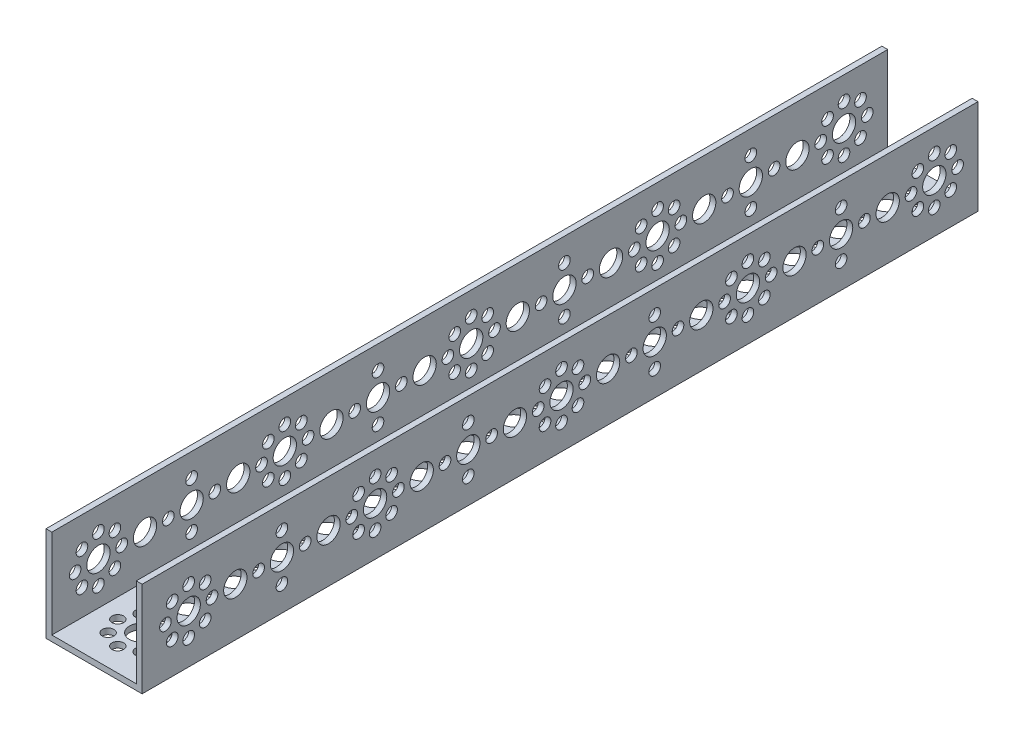
from build123d import *

# Parameters (mm, degrees)
BOSS_EXTRU_1_DEPTH                    = 287
ESQUISSE2_R                           = 4
ENL_V_MAT_EXTRU_1_DEPTH               = 291.724543168
R_P_TITION_LIN_AIRE1_COUNT            = 17
R_P_TITION_LIN_AIRE1_PITCH            = 16
ESQUISSE3_R                           = 2
ENL_V_MAT_EXTRU_2_DEPTH               = 291.724543168
R_P_TITION_CIRCULAIRE1_COUNT          = 4
R_P_TITION_CIRCULAIRE2_COUNT          = 8
R_P_TITION_LIN_AIRE2_COUNT            = 17
R_P_TITION_LIN_AIRE2_PITCH            = 16
R_P_TITION_LIN_AIRE2_COPY_1_SKETCH_R  = 2
R_P_TITION_LIN_AIRE2_COPY_1_DEPTH     = 291.724543168
R_P_TITION_LIN_AIRE2_COPY_2_SKETCH_R  = 2
R_P_TITION_LIN_AIRE2_COPY_2_DEPTH     = 291.724543168
R_P_TITION_LIN_AIRE2_COPY_3_SKETCH_R  = 2
R_P_TITION_LIN_AIRE2_COPY_3_DEPTH     = 291.724543168
R_P_TITION_LIN_AIRE2_COPY_4_SKETCH_R  = 2
R_P_TITION_LIN_AIRE2_COPY_4_DEPTH     = 291.724543168
R_P_TITION_LIN_AIRE2_COPY_5_SKETCH_R  = 2
R_P_TITION_LIN_AIRE2_COPY_5_DEPTH     = 291.724543168
R_P_TITION_LIN_AIRE2_COPY_6_SKETCH_R  = 2
R_P_TITION_LIN_AIRE2_COPY_6_DEPTH     = 291.724543168
R_P_TITION_LIN_AIRE2_COPY_7_SKETCH_R  = 2
R_P_TITION_LIN_AIRE2_COPY_7_DEPTH     = 291.724543168
R_P_TITION_LIN_AIRE2_COPY_8_SKETCH_R  = 2
R_P_TITION_LIN_AIRE2_COPY_8_DEPTH     = 291.724543168
R_P_TITION_LIN_AIRE2_COPY_9_SKETCH_R  = 2
R_P_TITION_LIN_AIRE2_COPY_9_DEPTH     = 291.724543168
R_P_TITION_LIN_AIRE2_COPY_10_SKETCH_R = 2
R_P_TITION_LIN_AIRE2_COPY_10_DEPTH    = 291.724543168
R_P_TITION_LIN_AIRE2_COPY_11_SKETCH_R = 2
R_P_TITION_LIN_AIRE2_COPY_11_DEPTH    = 291.724543168
R_P_TITION_LIN_AIRE2_COPY_12_SKETCH_R = 2
R_P_TITION_LIN_AIRE2_COPY_12_DEPTH    = 291.724543168
R_P_TITION_LIN_AIRE2_COPY_13_SKETCH_R = 2
R_P_TITION_LIN_AIRE2_COPY_13_DEPTH    = 291.724543168
R_P_TITION_LIN_AIRE2_COPY_14_SKETCH_R = 2
R_P_TITION_LIN_AIRE2_COPY_14_DEPTH    = 291.724543168
R_P_TITION_LIN_AIRE2_COPY_15_SKETCH_R = 2
R_P_TITION_LIN_AIRE2_COPY_15_DEPTH    = 291.724543168
R_P_TITION_LIN_AIRE2_COPY_16_SKETCH_R = 2
R_P_TITION_LIN_AIRE2_COPY_16_DEPTH    = 291.724543168
R_P_TITION_LIN_AIRE2_COPY_17_SKETCH_R = 2
R_P_TITION_LIN_AIRE2_COPY_17_DEPTH    = 291.724543168
R_P_TITION_LIN_AIRE2_COPY_18_SKETCH_R = 2
R_P_TITION_LIN_AIRE2_COPY_18_DEPTH    = 291.724543168
R_P_TITION_LIN_AIRE2_COPY_19_SKETCH_R = 2
R_P_TITION_LIN_AIRE2_COPY_19_DEPTH    = 291.724543168
R_P_TITION_LIN_AIRE2_COPY_20_SKETCH_R = 2
R_P_TITION_LIN_AIRE2_COPY_20_DEPTH    = 291.724543168
R_P_TITION_LIN_AIRE2_COPY_21_SKETCH_R = 2
R_P_TITION_LIN_AIRE2_COPY_21_DEPTH    = 291.724543168
R_P_TITION_LIN_AIRE2_COPY_22_SKETCH_R = 2
R_P_TITION_LIN_AIRE2_COPY_22_DEPTH    = 291.724543168
R_P_TITION_LIN_AIRE2_COPY_23_SKETCH_R = 2
R_P_TITION_LIN_AIRE2_COPY_23_DEPTH    = 291.724543168
R_P_TITION_LIN_AIRE2_COPY_24_SKETCH_R = 2
R_P_TITION_LIN_AIRE2_COPY_24_DEPTH    = 291.724543168
R_P_TITION_LIN_AIRE3_COPY_1_SKETCH_R  = 2
R_P_TITION_LIN_AIRE3_COPY_1_DEPTH     = 291.724543168
R_P_TITION_LIN_AIRE3_COPY_2_SKETCH_R  = 2
R_P_TITION_LIN_AIRE3_COPY_2_DEPTH     = 291.724543168
R_P_TITION_LIN_AIRE3_COPY_3_SKETCH_R  = 2
R_P_TITION_LIN_AIRE3_COPY_3_DEPTH     = 291.724543168
R_P_TITION_LIN_AIRE3_COPY_4_SKETCH_R  = 2
R_P_TITION_LIN_AIRE3_COPY_4_DEPTH     = 291.724543168
R_P_TITION_LIN_AIRE3_COPY_5_SKETCH_R  = 2
R_P_TITION_LIN_AIRE3_COPY_5_DEPTH     = 291.724543168
R_P_TITION_LIN_AIRE3_COPY_6_SKETCH_R  = 2
R_P_TITION_LIN_AIRE3_COPY_6_DEPTH     = 291.724543168
R_P_TITION_LIN_AIRE3_COPY_7_SKETCH_R  = 2
R_P_TITION_LIN_AIRE3_COPY_7_DEPTH     = 291.724543168
R_P_TITION_LIN_AIRE3_COPY_8_SKETCH_R  = 2
R_P_TITION_LIN_AIRE3_COPY_8_DEPTH     = 291.724543168
R_P_TITION_LIN_AIRE3_COPY_9_SKETCH_R  = 2
R_P_TITION_LIN_AIRE3_COPY_9_DEPTH     = 291.724543168
R_P_TITION_LIN_AIRE3_COPY_10_SKETCH_R = 2
R_P_TITION_LIN_AIRE3_COPY_10_DEPTH    = 291.724543168
R_P_TITION_LIN_AIRE3_COPY_11_SKETCH_R = 2
R_P_TITION_LIN_AIRE3_COPY_11_DEPTH    = 291.724543168
R_P_TITION_LIN_AIRE3_COPY_12_SKETCH_R = 2
R_P_TITION_LIN_AIRE3_COPY_12_DEPTH    = 291.724543168
R_P_TITION_LIN_AIRE3_COPY_13_SKETCH_R = 2
R_P_TITION_LIN_AIRE3_COPY_13_DEPTH    = 291.724543168
R_P_TITION_LIN_AIRE3_COPY_14_SKETCH_R = 2
R_P_TITION_LIN_AIRE3_COPY_14_DEPTH    = 291.724543168
R_P_TITION_LIN_AIRE3_COPY_15_SKETCH_R = 2
R_P_TITION_LIN_AIRE3_COPY_15_DEPTH    = 291.724543168
R_P_TITION_LIN_AIRE3_COPY_16_SKETCH_R = 2
R_P_TITION_LIN_AIRE3_COPY_16_DEPTH    = 291.724543168
R_P_TITION_LIN_AIRE3_COPY_17_SKETCH_R = 2
R_P_TITION_LIN_AIRE3_COPY_17_DEPTH    = 291.724543168
R_P_TITION_LIN_AIRE3_COPY_18_SKETCH_R = 2
R_P_TITION_LIN_AIRE3_COPY_18_DEPTH    = 291.724543168
R_P_TITION_LIN_AIRE3_COPY_19_SKETCH_R = 2
R_P_TITION_LIN_AIRE3_COPY_19_DEPTH    = 291.724543168
R_P_TITION_LIN_AIRE3_COPY_20_SKETCH_R = 2
R_P_TITION_LIN_AIRE3_COPY_20_DEPTH    = 291.724543168
SYM_TRIE2_COPY_1_SKETCH_R             = 4
SYM_TRIE2_COPY_1_DEPTH                = 291.724543168
SYM_TRIE2_COPY_2_SKETCH_R             = 4
SYM_TRIE2_COPY_2_DEPTH                = 291.724543168
SYM_TRIE2_COPY_3_SKETCH_R             = 4
SYM_TRIE2_COPY_3_DEPTH                = 291.724543168
SYM_TRIE2_COPY_4_SKETCH_R             = 4
SYM_TRIE2_COPY_4_DEPTH                = 291.724543168
SYM_TRIE2_COPY_5_SKETCH_R             = 4
SYM_TRIE2_COPY_5_DEPTH                = 291.724543168
SYM_TRIE2_COPY_6_SKETCH_R             = 4
SYM_TRIE2_COPY_6_DEPTH                = 291.724543168
SYM_TRIE2_COPY_7_SKETCH_R             = 4
SYM_TRIE2_COPY_7_DEPTH                = 291.724543168
SYM_TRIE2_COPY_8_SKETCH_R             = 4
SYM_TRIE2_COPY_8_DEPTH                = 291.724543168
SYM_TRIE2_COPY_9_SKETCH_R             = 4
SYM_TRIE2_COPY_9_DEPTH                = 291.724543168
SYM_TRIE2_COPY_10_SKETCH_R            = 4
SYM_TRIE2_COPY_10_DEPTH               = 291.724543168
SYM_TRIE2_COPY_11_SKETCH_R            = 4
SYM_TRIE2_COPY_11_DEPTH               = 291.724543168
SYM_TRIE2_COPY_12_SKETCH_R            = 4
SYM_TRIE2_COPY_12_DEPTH               = 291.724543168
SYM_TRIE2_COPY_13_SKETCH_R            = 4
SYM_TRIE2_COPY_13_DEPTH               = 291.724543168
SYM_TRIE2_COPY_14_SKETCH_R            = 4
SYM_TRIE2_COPY_14_DEPTH               = 291.724543168
SYM_TRIE2_COPY_15_SKETCH_R            = 4
SYM_TRIE2_COPY_15_DEPTH               = 291.724543168
SYM_TRIE2_COPY_16_SKETCH_R            = 4
SYM_TRIE2_COPY_16_DEPTH               = 291.724543168
SYM_TRIE2_COPY_17_SKETCH_R            = 2
SYM_TRIE2_COPY_17_DEPTH               = 291.724543168
SYM_TRIE2_COPY_18_SKETCH_R            = 2
SYM_TRIE2_COPY_18_DEPTH               = 291.724543168
SYM_TRIE2_COPY_19_SKETCH_R            = 2
SYM_TRIE2_COPY_19_DEPTH               = 291.724543168
SYM_TRIE2_COPY_20_SKETCH_R            = 2
SYM_TRIE2_COPY_20_DEPTH               = 291.724543168
SYM_TRIE2_COPY_21_SKETCH_R            = 2
SYM_TRIE2_COPY_21_DEPTH               = 291.724543168
SYM_TRIE2_COPY_22_SKETCH_R            = 2
SYM_TRIE2_COPY_22_DEPTH               = 291.724543168
SYM_TRIE2_COPY_23_SKETCH_R            = 2
SYM_TRIE2_COPY_23_DEPTH               = 291.724543168
SYM_TRIE2_COPY_24_SKETCH_R            = 2
SYM_TRIE2_COPY_24_DEPTH               = 291.724543168
SYM_TRIE2_COPY_25_SKETCH_R            = 2
SYM_TRIE2_COPY_25_DEPTH               = 291.724543168
SYM_TRIE2_COPY_26_SKETCH_R            = 2
SYM_TRIE2_COPY_26_DEPTH               = 291.724543168
SYM_TRIE2_COPY_27_SKETCH_R            = 2
SYM_TRIE2_COPY_27_DEPTH               = 291.724543168
SYM_TRIE2_COPY_28_SKETCH_R            = 2
SYM_TRIE2_COPY_28_DEPTH               = 291.724543168
SYM_TRIE2_COPY_29_SKETCH_R            = 2
SYM_TRIE2_COPY_29_DEPTH               = 291.724543168
SYM_TRIE2_COPY_30_SKETCH_R            = 2
SYM_TRIE2_COPY_30_DEPTH               = 291.724543168
SYM_TRIE2_COPY_31_SKETCH_R            = 2
SYM_TRIE2_COPY_31_DEPTH               = 291.724543168
SYM_TRIE2_COPY_32_SKETCH_R            = 2
SYM_TRIE2_COPY_32_DEPTH               = 291.724543168
SYM_TRIE2_COPY_33_SKETCH_R            = 2
SYM_TRIE2_COPY_33_DEPTH               = 291.724543168
SYM_TRIE2_COPY_34_SKETCH_R            = 2
SYM_TRIE2_COPY_34_DEPTH               = 291.724543168
SYM_TRIE2_COPY_35_SKETCH_R            = 2
SYM_TRIE2_COPY_35_DEPTH               = 291.724543168
SYM_TRIE2_COPY_36_SKETCH_R            = 2
SYM_TRIE2_COPY_36_DEPTH               = 291.724543168
SYM_TRIE2_COPY_37_SKETCH_R            = 2
SYM_TRIE2_COPY_37_DEPTH               = 291.724543168
SYM_TRIE2_COPY_38_SKETCH_R            = 2
SYM_TRIE2_COPY_38_DEPTH               = 291.724543168
SYM_TRIE2_COPY_39_SKETCH_R            = 2
SYM_TRIE2_COPY_39_DEPTH               = 291.724543168
SYM_TRIE2_COPY_40_SKETCH_R            = 2
SYM_TRIE2_COPY_40_DEPTH               = 291.724543168
SYM_TRIE2_COPY_41_SKETCH_R            = 2
SYM_TRIE2_COPY_41_DEPTH               = 291.724543168
SYM_TRIE2_COPY_42_SKETCH_R            = 2
SYM_TRIE2_COPY_42_DEPTH               = 291.724543168
SYM_TRIE2_COPY_43_SKETCH_R            = 2
SYM_TRIE2_COPY_43_DEPTH               = 291.724543168
SYM_TRIE2_COPY_44_SKETCH_R            = 2
SYM_TRIE2_COPY_44_DEPTH               = 291.724543168
SYM_TRIE2_COPY_45_SKETCH_R            = 2
SYM_TRIE2_COPY_45_DEPTH               = 291.724543168
SYM_TRIE2_COPY_46_SKETCH_R            = 2
SYM_TRIE2_COPY_46_DEPTH               = 291.724543168
SYM_TRIE2_COPY_47_SKETCH_R            = 2
SYM_TRIE2_COPY_47_DEPTH               = 291.724543168
SYM_TRIE2_COPY_48_SKETCH_R            = 2
SYM_TRIE2_COPY_48_DEPTH               = 291.724543168
SYM_TRIE2_COPY_49_SKETCH_R            = 2
SYM_TRIE2_COPY_49_DEPTH               = 291.724543168
SYM_TRIE2_COPY_50_SKETCH_R            = 2
SYM_TRIE2_COPY_50_DEPTH               = 291.724543168
SYM_TRIE2_COPY_51_SKETCH_R            = 2
SYM_TRIE2_COPY_51_DEPTH               = 291.724543168
SYM_TRIE2_COPY_52_SKETCH_R            = 2
SYM_TRIE2_COPY_52_DEPTH               = 291.724543168
SYM_TRIE2_COPY_53_SKETCH_R            = 2
SYM_TRIE2_COPY_53_DEPTH               = 291.724543168
SYM_TRIE2_COPY_54_SKETCH_R            = 2
SYM_TRIE2_COPY_54_DEPTH               = 291.724543168
SYM_TRIE2_COPY_55_SKETCH_R            = 2
SYM_TRIE2_COPY_55_DEPTH               = 291.724543168
SYM_TRIE2_COPY_56_SKETCH_R            = 2
SYM_TRIE2_COPY_56_DEPTH               = 291.724543168
SYM_TRIE2_COPY_57_SKETCH_R            = 2
SYM_TRIE2_COPY_57_DEPTH               = 291.724543168
SYM_TRIE2_COPY_58_SKETCH_R            = 2
SYM_TRIE2_COPY_58_DEPTH               = 291.724543168
SYM_TRIE2_COPY_59_SKETCH_R            = 2
SYM_TRIE2_COPY_59_DEPTH               = 291.724543168
SYM_TRIE2_COPY_60_SKETCH_R            = 2
SYM_TRIE2_COPY_60_DEPTH               = 291.724543168
SYM_TRIE2_COPY_61_SKETCH_R            = 2
SYM_TRIE2_COPY_61_DEPTH               = 291.724543168
SYM_TRIE2_COPY_62_SKETCH_R            = 2
SYM_TRIE2_COPY_62_DEPTH               = 291.724543168
SYM_TRIE2_COPY_63_SKETCH_R            = 2
SYM_TRIE2_COPY_63_DEPTH               = 291.724543168
SYM_TRIE2_COPY_64_SKETCH_R            = 2
SYM_TRIE2_COPY_64_DEPTH               = 291.724543168
SYM_TRIE2_COPY_65_SKETCH_R            = 2
SYM_TRIE2_COPY_65_DEPTH               = 291.724543168
SYM_TRIE2_COPY_66_SKETCH_R            = 2
SYM_TRIE2_COPY_66_DEPTH               = 291.724543168
SYM_TRIE2_COPY_67_SKETCH_R            = 2
SYM_TRIE2_COPY_67_DEPTH               = 291.724543168
SYM_TRIE2_COPY_68_SKETCH_R            = 2
SYM_TRIE2_COPY_68_DEPTH               = 291.724543168
SYM_TRIE2_COPY_69_SKETCH_R            = 2
SYM_TRIE2_COPY_69_DEPTH               = 291.724543168
SYM_TRIE2_COPY_70_SKETCH_R            = 2
SYM_TRIE2_COPY_70_DEPTH               = 291.724543168
SYM_TRIE2_COPY_71_SKETCH_R            = 2
SYM_TRIE2_COPY_71_DEPTH               = 291.724543168
SYM_TRIE2_COPY_72_SKETCH_R            = 2
SYM_TRIE2_COPY_72_DEPTH               = 291.724543168
SYM_TRIE2_COPY_73_SKETCH_R            = 2
SYM_TRIE2_COPY_73_DEPTH               = 291.724543168
SYM_TRIE2_COPY_74_SKETCH_R            = 2
SYM_TRIE2_COPY_74_DEPTH               = 291.724543168
SYM_TRIE2_COPY_75_SKETCH_R            = 2
SYM_TRIE2_COPY_75_DEPTH               = 291.724543168


with BuildPart() as part:
    # Esquisse1 → Boss.-Extru.1 (new body)
    with BuildSketch(Plane.XY):
        Polygon((0, 0), (0, 32.6), (2, 32.6), (2, 2), (31, 2), (31, 32.6), (33, 32.6), (33, 0), align=None)
    extrude(amount=BOSS_EXTRU_1_DEPTH)

    # Esquisse2 → Enlèv. mat.-Extru.1 (cut, symmetric)
    with BuildSketch(Plane(origin=(0, 0, 0), x_dir=(-1, 0, 0), z_dir=(0, -1, 0))):
        with Locations(Location((-16.65, -271, 0), (0, 0, 90))):
            Circle(ESQUISSE2_R)
    enl_v_mat_extru_1 = extrude(amount=ENL_V_MAT_EXTRU_1_DEPTH, both=True, mode=Mode.SUBTRACT)

    # Répétition linéaire1: Enlèv. mat.-Extru.1 ×17
    with Locations(*[(0, 0, -i * R_P_TITION_LIN_AIRE1_PITCH) for i in range(1, R_P_TITION_LIN_AIRE1_COUNT)]):
        add(enl_v_mat_extru_1, mode=Mode.SUBTRACT)

    # Esquisse3 → Enlèv. mat.-Extru.2 (cut, symmetric)
    with BuildSketch(Plane.XZ):
        with Locations(Location((24.65, 271, 0), (0, 0, 270))):
            Circle(ESQUISSE3_R)
    enl_v_mat_extru_2 = extrude(amount=ENL_V_MAT_EXTRU_2_DEPTH, both=True, mode=Mode.SUBTRACT)

    # Répétition circulaire1: Enlèv. mat.-Extru.2 ×4 about axis
    r_p_tition_circulaire1_axis = Axis((16.65, 0, 271), (0, 1, 0))
    for i in range(1, R_P_TITION_CIRCULAIRE1_COUNT):
        add(enl_v_mat_extru_2.rotate(r_p_tition_circulaire1_axis, i * 360 / R_P_TITION_CIRCULAIRE1_COUNT), mode=Mode.SUBTRACT)

    # Répétition circulaire2: Enlèv. mat.-Extru.2 ×8 about axis, 3 skipped
    r_p_tition_circulaire2_axis = Axis((16.65, 0, 271), (0, 1, 0))
    add([enl_v_mat_extru_2.rotate(r_p_tition_circulaire2_axis, i * 360 / R_P_TITION_CIRCULAIRE2_COUNT) for i in range(1, R_P_TITION_CIRCULAIRE2_COUNT) if i not in (2, 4, 6)], mode=Mode.SUBTRACT)

    # Répétition linéaire2: Enlèv. mat.-Extru.2 ×17, 8 skipped
    with Locations(*[(0, 0, -i * R_P_TITION_LIN_AIRE2_PITCH) for i in range(1, R_P_TITION_LIN_AIRE2_COUNT) if i not in (1, 3, 5, 7, 9, 11, 13, 15)]):
        add(enl_v_mat_extru_2, mode=Mode.SUBTRACT)

    # Répétition linéaire2 copy 1 sketch → Répétition linéaire2 copy 1 (cut, symmetric)
    with BuildSketch(Plane(origin=(-254.35, 0, 255.65), x_dir=(0, 0, -1), z_dir=(0, -1, 0))):
        with Locations(Location((24.65, 271, 0), (0, 0, 270))):
            Circle(R_P_TITION_LIN_AIRE2_COPY_1_SKETCH_R)
    extrude(amount=R_P_TITION_LIN_AIRE2_COPY_1_DEPTH, both=True, mode=Mode.SUBTRACT)

    # Répétition linéaire2 copy 2 sketch → Répétition linéaire2 copy 2 (cut, symmetric)
    with BuildSketch(Plane(origin=(-254.35, 0, 223.65), x_dir=(0, 0, -1), z_dir=(0, -1, 0))):
        with Locations(Location((24.65, 271, 0), (0, 0, 270))):
            Circle(R_P_TITION_LIN_AIRE2_COPY_2_SKETCH_R)
    extrude(amount=R_P_TITION_LIN_AIRE2_COPY_2_DEPTH, both=True, mode=Mode.SUBTRACT)

    # Répétition linéaire2 copy 3 sketch → Répétition linéaire2 copy 3 (cut, symmetric)
    with BuildSketch(Plane(origin=(-254.35, 0, 191.65), x_dir=(0, 0, -1), z_dir=(0, -1, 0))):
        with Locations(Location((24.65, 271, 0), (0, 0, 270))):
            Circle(R_P_TITION_LIN_AIRE2_COPY_3_SKETCH_R)
    extrude(amount=R_P_TITION_LIN_AIRE2_COPY_3_DEPTH, both=True, mode=Mode.SUBTRACT)

    # Répétition linéaire2 copy 4 sketch → Répétition linéaire2 copy 4 (cut, symmetric)
    with BuildSketch(Plane(origin=(-254.35, 0, 159.65), x_dir=(0, 0, -1), z_dir=(0, -1, 0))):
        with Locations(Location((24.65, 271, 0), (0, 0, 270))):
            Circle(R_P_TITION_LIN_AIRE2_COPY_4_SKETCH_R)
    extrude(amount=R_P_TITION_LIN_AIRE2_COPY_4_DEPTH, both=True, mode=Mode.SUBTRACT)

    # Répétition linéaire2 copy 5 sketch → Répétition linéaire2 copy 5 (cut, symmetric)
    with BuildSketch(Plane(origin=(-254.35, 0, 127.65), x_dir=(0, 0, -1), z_dir=(0, -1, 0))):
        with Locations(Location((24.65, 271, 0), (0, 0, 270))):
            Circle(R_P_TITION_LIN_AIRE2_COPY_5_SKETCH_R)
    extrude(amount=R_P_TITION_LIN_AIRE2_COPY_5_DEPTH, both=True, mode=Mode.SUBTRACT)

    # Répétition linéaire2 copy 6 sketch → Répétition linéaire2 copy 6 (cut, symmetric)
    with BuildSketch(Plane(origin=(-254.35, 0, 95.65), x_dir=(0, 0, -1), z_dir=(0, -1, 0))):
        with Locations(Location((24.65, 271, 0), (0, 0, 270))):
            Circle(R_P_TITION_LIN_AIRE2_COPY_6_SKETCH_R)
    extrude(amount=R_P_TITION_LIN_AIRE2_COPY_6_DEPTH, both=True, mode=Mode.SUBTRACT)

    # Répétition linéaire2 copy 7 sketch → Répétition linéaire2 copy 7 (cut, symmetric)
    with BuildSketch(Plane(origin=(-254.35, 0, 63.65), x_dir=(0, 0, -1), z_dir=(0, -1, 0))):
        with Locations(Location((24.65, 271, 0), (0, 0, 270))):
            Circle(R_P_TITION_LIN_AIRE2_COPY_7_SKETCH_R)
    extrude(amount=R_P_TITION_LIN_AIRE2_COPY_7_DEPTH, both=True, mode=Mode.SUBTRACT)

    # Répétition linéaire2 copy 8 sketch → Répétition linéaire2 copy 8 (cut, symmetric)
    with BuildSketch(Plane(origin=(-254.35, 0, 31.65), x_dir=(0, 0, -1), z_dir=(0, -1, 0))):
        with Locations(Location((24.65, 271, 0), (0, 0, 270))):
            Circle(R_P_TITION_LIN_AIRE2_COPY_8_SKETCH_R)
    extrude(amount=R_P_TITION_LIN_AIRE2_COPY_8_DEPTH, both=True, mode=Mode.SUBTRACT)

    # Répétition linéaire2 copy 9 sketch → Répétition linéaire2 copy 9 (cut, symmetric)
    with BuildSketch(Plane(origin=(33.3, 0, 510), x_dir=(-1, 0, 0), z_dir=(0, -1, 0))):
        with Locations(Location((24.65, 271, 0), (0, 0, 270))):
            Circle(R_P_TITION_LIN_AIRE2_COPY_9_SKETCH_R)
    extrude(amount=R_P_TITION_LIN_AIRE2_COPY_9_DEPTH, both=True, mode=Mode.SUBTRACT)

    # Répétition linéaire2 copy 10 sketch → Répétition linéaire2 copy 10 (cut, symmetric)
    with BuildSketch(Plane(origin=(33.3, 0, 478), x_dir=(-1, 0, 0), z_dir=(0, -1, 0))):
        with Locations(Location((24.65, 271, 0), (0, 0, 270))):
            Circle(R_P_TITION_LIN_AIRE2_COPY_10_SKETCH_R)
    extrude(amount=R_P_TITION_LIN_AIRE2_COPY_10_DEPTH, both=True, mode=Mode.SUBTRACT)

    # Répétition linéaire2 copy 11 sketch → Répétition linéaire2 copy 11 (cut, symmetric)
    with BuildSketch(Plane(origin=(33.3, 0, 446), x_dir=(-1, 0, 0), z_dir=(0, -1, 0))):
        with Locations(Location((24.65, 271, 0), (0, 0, 270))):
            Circle(R_P_TITION_LIN_AIRE2_COPY_11_SKETCH_R)
    extrude(amount=R_P_TITION_LIN_AIRE2_COPY_11_DEPTH, both=True, mode=Mode.SUBTRACT)

    # Répétition linéaire2 copy 12 sketch → Répétition linéaire2 copy 12 (cut, symmetric)
    with BuildSketch(Plane(origin=(33.3, 0, 414), x_dir=(-1, 0, 0), z_dir=(0, -1, 0))):
        with Locations(Location((24.65, 271, 0), (0, 0, 270))):
            Circle(R_P_TITION_LIN_AIRE2_COPY_12_SKETCH_R)
    extrude(amount=R_P_TITION_LIN_AIRE2_COPY_12_DEPTH, both=True, mode=Mode.SUBTRACT)

    # Répétition linéaire2 copy 13 sketch → Répétition linéaire2 copy 13 (cut, symmetric)
    with BuildSketch(Plane(origin=(33.3, 0, 382), x_dir=(-1, 0, 0), z_dir=(0, -1, 0))):
        with Locations(Location((24.65, 271, 0), (0, 0, 270))):
            Circle(R_P_TITION_LIN_AIRE2_COPY_13_SKETCH_R)
    extrude(amount=R_P_TITION_LIN_AIRE2_COPY_13_DEPTH, both=True, mode=Mode.SUBTRACT)

    # Répétition linéaire2 copy 14 sketch → Répétition linéaire2 copy 14 (cut, symmetric)
    with BuildSketch(Plane(origin=(33.3, 0, 350), x_dir=(-1, 0, 0), z_dir=(0, -1, 0))):
        with Locations(Location((24.65, 271, 0), (0, 0, 270))):
            Circle(R_P_TITION_LIN_AIRE2_COPY_14_SKETCH_R)
    extrude(amount=R_P_TITION_LIN_AIRE2_COPY_14_DEPTH, both=True, mode=Mode.SUBTRACT)

    # Répétition linéaire2 copy 15 sketch → Répétition linéaire2 copy 15 (cut, symmetric)
    with BuildSketch(Plane(origin=(33.3, 0, 318), x_dir=(-1, 0, 0), z_dir=(0, -1, 0))):
        with Locations(Location((24.65, 271, 0), (0, 0, 270))):
            Circle(R_P_TITION_LIN_AIRE2_COPY_15_SKETCH_R)
    extrude(amount=R_P_TITION_LIN_AIRE2_COPY_15_DEPTH, both=True, mode=Mode.SUBTRACT)

    # Répétition linéaire2 copy 16 sketch → Répétition linéaire2 copy 16 (cut, symmetric)
    with BuildSketch(Plane(origin=(33.3, 0, 286), x_dir=(-1, 0, 0), z_dir=(0, -1, 0))):
        with Locations(Location((24.65, 271, 0), (0, 0, 270))):
            Circle(R_P_TITION_LIN_AIRE2_COPY_16_SKETCH_R)
    extrude(amount=R_P_TITION_LIN_AIRE2_COPY_16_DEPTH, both=True, mode=Mode.SUBTRACT)

    # Répétition linéaire2 copy 17 sketch → Répétition linéaire2 copy 17 (cut, symmetric)
    with BuildSketch(Plane(origin=(287.65, 0, 222.35), x_dir=(0, 0, 1), z_dir=(0, -1, 0))):
        with Locations(Location((24.65, 271, 0), (0, 0, 270))):
            Circle(R_P_TITION_LIN_AIRE2_COPY_17_SKETCH_R)
    extrude(amount=R_P_TITION_LIN_AIRE2_COPY_17_DEPTH, both=True, mode=Mode.SUBTRACT)

    # Répétition linéaire2 copy 18 sketch → Répétition linéaire2 copy 18 (cut, symmetric)
    with BuildSketch(Plane(origin=(287.65, 0, 190.35), x_dir=(0, 0, 1), z_dir=(0, -1, 0))):
        with Locations(Location((24.65, 271, 0), (0, 0, 270))):
            Circle(R_P_TITION_LIN_AIRE2_COPY_18_SKETCH_R)
    extrude(amount=R_P_TITION_LIN_AIRE2_COPY_18_DEPTH, both=True, mode=Mode.SUBTRACT)

    # Répétition linéaire2 copy 19 sketch → Répétition linéaire2 copy 19 (cut, symmetric)
    with BuildSketch(Plane(origin=(287.65, 0, 158.35), x_dir=(0, 0, 1), z_dir=(0, -1, 0))):
        with Locations(Location((24.65, 271, 0), (0, 0, 270))):
            Circle(R_P_TITION_LIN_AIRE2_COPY_19_SKETCH_R)
    extrude(amount=R_P_TITION_LIN_AIRE2_COPY_19_DEPTH, both=True, mode=Mode.SUBTRACT)

    # Répétition linéaire2 copy 20 sketch → Répétition linéaire2 copy 20 (cut, symmetric)
    with BuildSketch(Plane(origin=(287.65, 0, 126.35), x_dir=(0, 0, 1), z_dir=(0, -1, 0))):
        with Locations(Location((24.65, 271, 0), (0, 0, 270))):
            Circle(R_P_TITION_LIN_AIRE2_COPY_20_SKETCH_R)
    extrude(amount=R_P_TITION_LIN_AIRE2_COPY_20_DEPTH, both=True, mode=Mode.SUBTRACT)

    # Répétition linéaire2 copy 21 sketch → Répétition linéaire2 copy 21 (cut, symmetric)
    with BuildSketch(Plane(origin=(287.65, 0, 94.35), x_dir=(0, 0, 1), z_dir=(0, -1, 0))):
        with Locations(Location((24.65, 271, 0), (0, 0, 270))):
            Circle(R_P_TITION_LIN_AIRE2_COPY_21_SKETCH_R)
    extrude(amount=R_P_TITION_LIN_AIRE2_COPY_21_DEPTH, both=True, mode=Mode.SUBTRACT)

    # Répétition linéaire2 copy 22 sketch → Répétition linéaire2 copy 22 (cut, symmetric)
    with BuildSketch(Plane(origin=(287.65, 0, 62.35), x_dir=(0, 0, 1), z_dir=(0, -1, 0))):
        with Locations(Location((24.65, 271, 0), (0, 0, 270))):
            Circle(R_P_TITION_LIN_AIRE2_COPY_22_SKETCH_R)
    extrude(amount=R_P_TITION_LIN_AIRE2_COPY_22_DEPTH, both=True, mode=Mode.SUBTRACT)

    # Répétition linéaire2 copy 23 sketch → Répétition linéaire2 copy 23 (cut, symmetric)
    with BuildSketch(Plane(origin=(287.65, 0, 30.35), x_dir=(0, 0, 1), z_dir=(0, -1, 0))):
        with Locations(Location((24.65, 271, 0), (0, 0, 270))):
            Circle(R_P_TITION_LIN_AIRE2_COPY_23_SKETCH_R)
    extrude(amount=R_P_TITION_LIN_AIRE2_COPY_23_DEPTH, both=True, mode=Mode.SUBTRACT)

    # Répétition linéaire2 copy 24 sketch → Répétition linéaire2 copy 24 (cut, symmetric)
    with BuildSketch(Plane(origin=(287.65, 0, -1.65), x_dir=(0, 0, 1), z_dir=(0, -1, 0))):
        with Locations(Location((24.65, 271, 0), (0, 0, 270))):
            Circle(R_P_TITION_LIN_AIRE2_COPY_24_SKETCH_R)
    extrude(amount=R_P_TITION_LIN_AIRE2_COPY_24_DEPTH, both=True, mode=Mode.SUBTRACT)

    # Répétition linéaire3 copy 1 sketch → Répétition linéaire3 copy 1 (cut, symmetric)
    with BuildSketch(Plane(origin=(-186.749265608, 0, 27.147390205), x_dir=(0.7071067811865476, 0, -0.7071067811865475), z_dir=(0, -1, 0))):
        with Locations(Location((24.65, 271, 0), (0, 0, 270))):
            Circle(R_P_TITION_LIN_AIRE3_COPY_1_SKETCH_R)
    extrude(amount=R_P_TITION_LIN_AIRE3_COPY_1_DEPTH, both=True, mode=Mode.SUBTRACT)

    # Répétition linéaire3 copy 2 sketch → Répétition linéaire3 copy 2 (cut, symmetric)
    with BuildSketch(Plane(origin=(-186.749265608, 0, -36.852609795), x_dir=(0.7071067811865476, 0, -0.7071067811865475), z_dir=(0, -1, 0))):
        with Locations(Location((24.65, 271, 0), (0, 0, 270))):
            Circle(R_P_TITION_LIN_AIRE3_COPY_2_SKETCH_R)
    extrude(amount=R_P_TITION_LIN_AIRE3_COPY_2_DEPTH, both=True, mode=Mode.SUBTRACT)

    # Répétition linéaire3 copy 3 sketch → Répétition linéaire3 copy 3 (cut, symmetric)
    with BuildSketch(Plane(origin=(-186.749265608, 0, -100.852609795), x_dir=(0.7071067811865476, 0, -0.7071067811865475), z_dir=(0, -1, 0))):
        with Locations(Location((24.65, 271, 0), (0, 0, 270))):
            Circle(R_P_TITION_LIN_AIRE3_COPY_3_SKETCH_R)
    extrude(amount=R_P_TITION_LIN_AIRE3_COPY_3_DEPTH, both=True, mode=Mode.SUBTRACT)

    # Répétition linéaire3 copy 4 sketch → Répétition linéaire3 copy 4 (cut, symmetric)
    with BuildSketch(Plane(origin=(-186.749265608, 0, -164.852609795), x_dir=(0.7071067811865476, 0, -0.7071067811865475), z_dir=(0, -1, 0))):
        with Locations(Location((24.65, 271, 0), (0, 0, 270))):
            Circle(R_P_TITION_LIN_AIRE3_COPY_4_SKETCH_R)
    extrude(amount=R_P_TITION_LIN_AIRE3_COPY_4_DEPTH, both=True, mode=Mode.SUBTRACT)

    # Répétition linéaire3 copy 5 sketch → Répétition linéaire3 copy 5 (cut, symmetric)
    with BuildSketch(Plane(origin=(-163.202609795, 0, 410.399265608), x_dir=(-0.7071067811865475, 0, -0.7071067811865476), z_dir=(0, -1, 0))):
        with Locations(Location((24.65, 271, 0), (0, 0, 270))):
            Circle(R_P_TITION_LIN_AIRE3_COPY_5_SKETCH_R)
    extrude(amount=R_P_TITION_LIN_AIRE3_COPY_5_DEPTH, both=True, mode=Mode.SUBTRACT)

    # Répétition linéaire3 copy 6 sketch → Répétition linéaire3 copy 6 (cut, symmetric)
    with BuildSketch(Plane(origin=(-163.202609795, 0, 346.399265608), x_dir=(-0.7071067811865475, 0, -0.7071067811865476), z_dir=(0, -1, 0))):
        with Locations(Location((24.65, 271, 0), (0, 0, 270))):
            Circle(R_P_TITION_LIN_AIRE3_COPY_6_SKETCH_R)
    extrude(amount=R_P_TITION_LIN_AIRE3_COPY_6_DEPTH, both=True, mode=Mode.SUBTRACT)

    # Répétition linéaire3 copy 7 sketch → Répétition linéaire3 copy 7 (cut, symmetric)
    with BuildSketch(Plane(origin=(-163.202609795, 0, 282.399265608), x_dir=(-0.7071067811865475, 0, -0.7071067811865476), z_dir=(0, -1, 0))):
        with Locations(Location((24.65, 271, 0), (0, 0, 270))):
            Circle(R_P_TITION_LIN_AIRE3_COPY_7_SKETCH_R)
    extrude(amount=R_P_TITION_LIN_AIRE3_COPY_7_DEPTH, both=True, mode=Mode.SUBTRACT)

    # Répétition linéaire3 copy 8 sketch → Répétition linéaire3 copy 8 (cut, symmetric)
    with BuildSketch(Plane(origin=(-163.202609795, 0, 218.399265608), x_dir=(-0.7071067811865475, 0, -0.7071067811865476), z_dir=(0, -1, 0))):
        with Locations(Location((24.65, 271, 0), (0, 0, 270))):
            Circle(R_P_TITION_LIN_AIRE3_COPY_8_SKETCH_R)
    extrude(amount=R_P_TITION_LIN_AIRE3_COPY_8_DEPTH, both=True, mode=Mode.SUBTRACT)

    # Répétition linéaire3 copy 9 sketch → Répétition linéaire3 copy 9 (cut, symmetric)
    with BuildSketch(Plane(origin=(220.049265608, 0, 386.852609795), x_dir=(-0.7071067811865477, 0, 0.7071067811865475), z_dir=(0, -1, 0))):
        with Locations(Location((24.65, 271, 0), (0, 0, 270))):
            Circle(R_P_TITION_LIN_AIRE3_COPY_9_SKETCH_R)
    extrude(amount=R_P_TITION_LIN_AIRE3_COPY_9_DEPTH, both=True, mode=Mode.SUBTRACT)

    # Répétition linéaire3 copy 10 sketch → Répétition linéaire3 copy 10 (cut, symmetric)
    with BuildSketch(Plane(origin=(220.049265608, 0, 322.852609795), x_dir=(-0.7071067811865477, 0, 0.7071067811865475), z_dir=(0, -1, 0))):
        with Locations(Location((24.65, 271, 0), (0, 0, 270))):
            Circle(R_P_TITION_LIN_AIRE3_COPY_10_SKETCH_R)
    extrude(amount=R_P_TITION_LIN_AIRE3_COPY_10_DEPTH, both=True, mode=Mode.SUBTRACT)

    # Répétition linéaire3 copy 11 sketch → Répétition linéaire3 copy 11 (cut, symmetric)
    with BuildSketch(Plane(origin=(220.049265608, 0, 258.852609795), x_dir=(-0.7071067811865477, 0, 0.7071067811865475), z_dir=(0, -1, 0))):
        with Locations(Location((24.65, 271, 0), (0, 0, 270))):
            Circle(R_P_TITION_LIN_AIRE3_COPY_11_SKETCH_R)
    extrude(amount=R_P_TITION_LIN_AIRE3_COPY_11_DEPTH, both=True, mode=Mode.SUBTRACT)

    # Répétition linéaire3 copy 12 sketch → Répétition linéaire3 copy 12 (cut, symmetric)
    with BuildSketch(Plane(origin=(220.049265608, 0, 194.852609795), x_dir=(-0.7071067811865477, 0, 0.7071067811865475), z_dir=(0, -1, 0))):
        with Locations(Location((24.65, 271, 0), (0, 0, 270))):
            Circle(R_P_TITION_LIN_AIRE3_COPY_12_SKETCH_R)
    extrude(amount=R_P_TITION_LIN_AIRE3_COPY_12_DEPTH, both=True, mode=Mode.SUBTRACT)

    # Répétition linéaire3 copy 13 sketch → Répétition linéaire3 copy 13 (cut, symmetric)
    with BuildSketch(Plane(origin=(196.502609795, 0, 3.600734392), x_dir=(0.7071067811865474, 0, 0.7071067811865477), z_dir=(0, -1, 0))):
        with Locations(Location((24.65, 271, 0), (0, 0, 270))):
            Circle(R_P_TITION_LIN_AIRE3_COPY_13_SKETCH_R)
    extrude(amount=R_P_TITION_LIN_AIRE3_COPY_13_DEPTH, both=True, mode=Mode.SUBTRACT)

    # Répétition linéaire3 copy 14 sketch → Répétition linéaire3 copy 14 (cut, symmetric)
    with BuildSketch(Plane(origin=(196.502609795, 0, -60.399265608), x_dir=(0.7071067811865474, 0, 0.7071067811865477), z_dir=(0, -1, 0))):
        with Locations(Location((24.65, 271, 0), (0, 0, 270))):
            Circle(R_P_TITION_LIN_AIRE3_COPY_14_SKETCH_R)
    extrude(amount=R_P_TITION_LIN_AIRE3_COPY_14_DEPTH, both=True, mode=Mode.SUBTRACT)

    # Répétition linéaire3 copy 15 sketch → Répétition linéaire3 copy 15 (cut, symmetric)
    with BuildSketch(Plane(origin=(196.502609795, 0, -124.399265608), x_dir=(0.7071067811865474, 0, 0.7071067811865477), z_dir=(0, -1, 0))):
        with Locations(Location((24.65, 271, 0), (0, 0, 270))):
            Circle(R_P_TITION_LIN_AIRE3_COPY_15_SKETCH_R)
    extrude(amount=R_P_TITION_LIN_AIRE3_COPY_15_DEPTH, both=True, mode=Mode.SUBTRACT)

    # Répétition linéaire3 copy 16 sketch → Répétition linéaire3 copy 16 (cut, symmetric)
    with BuildSketch(Plane(origin=(196.502609795, 0, -188.399265608), x_dir=(0.7071067811865474, 0, 0.7071067811865477), z_dir=(0, -1, 0))):
        with Locations(Location((24.65, 271, 0), (0, 0, 270))):
            Circle(R_P_TITION_LIN_AIRE3_COPY_16_SKETCH_R)
    extrude(amount=R_P_TITION_LIN_AIRE3_COPY_16_DEPTH, both=True, mode=Mode.SUBTRACT)

    # Répétition linéaire3 copy 17 sketch → Répétition linéaire3 copy 17 (cut, symmetric)
    with BuildSketch(Plane(origin=(0, 0, -64), x_dir=(1, 0, 0), z_dir=(0, -1, 0))):
        with Locations(Location((24.65, 271, 0), (0, 0, 270))):
            Circle(R_P_TITION_LIN_AIRE3_COPY_17_SKETCH_R)
    extrude(amount=R_P_TITION_LIN_AIRE3_COPY_17_DEPTH, both=True, mode=Mode.SUBTRACT)

    # Répétition linéaire3 copy 18 sketch → Répétition linéaire3 copy 18 (cut, symmetric)
    with BuildSketch(Plane(origin=(0, 0, -128), x_dir=(1, 0, 0), z_dir=(0, -1, 0))):
        with Locations(Location((24.65, 271, 0), (0, 0, 270))):
            Circle(R_P_TITION_LIN_AIRE3_COPY_18_SKETCH_R)
    extrude(amount=R_P_TITION_LIN_AIRE3_COPY_18_DEPTH, both=True, mode=Mode.SUBTRACT)

    # Répétition linéaire3 copy 19 sketch → Répétition linéaire3 copy 19 (cut, symmetric)
    with BuildSketch(Plane(origin=(0, 0, -192), x_dir=(1, 0, 0), z_dir=(0, -1, 0))):
        with Locations(Location((24.65, 271, 0), (0, 0, 270))):
            Circle(R_P_TITION_LIN_AIRE3_COPY_19_SKETCH_R)
    extrude(amount=R_P_TITION_LIN_AIRE3_COPY_19_DEPTH, both=True, mode=Mode.SUBTRACT)

    # Répétition linéaire3 copy 20 sketch → Répétition linéaire3 copy 20 (cut, symmetric)
    with BuildSketch(Plane(origin=(0, 0, -256), x_dir=(1, 0, 0), z_dir=(0, -1, 0))):
        with Locations(Location((24.65, 271, 0), (0, 0, 270))):
            Circle(R_P_TITION_LIN_AIRE3_COPY_20_SKETCH_R)
    extrude(amount=R_P_TITION_LIN_AIRE3_COPY_20_DEPTH, both=True, mode=Mode.SUBTRACT)

    # Symétrie2: Enlèv. mat.-Extru.1, Enlèv. mat.-Extru.2 across plane
    add(enl_v_mat_extru_1.mirror(Plane(origin=(0, 0, 0), x_dir=(0, 0, 1), z_dir=(0.7071067811865477, -0.7071067811865475, 0))), mode=Mode.SUBTRACT)
    add(enl_v_mat_extru_2.mirror(Plane(origin=(0, 0, 0), x_dir=(0, 0, 1), z_dir=(0.7071067811865477, -0.7071067811865475, 0))), mode=Mode.SUBTRACT)

    # Symétrie2 copy 1 sketch → Symétrie2 copy 1 (cut, symmetric)
    with BuildSketch(Plane(origin=(0, 0, -16), x_dir=(0, -1, 0), z_dir=(-1, 0, 0))):
        with Locations((-16.65, 271)):
            Circle(SYM_TRIE2_COPY_1_SKETCH_R)
    extrude(amount=SYM_TRIE2_COPY_1_DEPTH, both=True, mode=Mode.SUBTRACT)

    # Symétrie2 copy 2 sketch → Symétrie2 copy 2 (cut, symmetric)
    with BuildSketch(Plane(origin=(0, 0, -32), x_dir=(0, -1, 0), z_dir=(-1, 0, 0))):
        with Locations((-16.65, 271)):
            Circle(SYM_TRIE2_COPY_2_SKETCH_R)
    extrude(amount=SYM_TRIE2_COPY_2_DEPTH, both=True, mode=Mode.SUBTRACT)

    # Symétrie2 copy 3 sketch → Symétrie2 copy 3 (cut, symmetric)
    with BuildSketch(Plane(origin=(0, 0, -48), x_dir=(0, -1, 0), z_dir=(-1, 0, 0))):
        with Locations((-16.65, 271)):
            Circle(SYM_TRIE2_COPY_3_SKETCH_R)
    extrude(amount=SYM_TRIE2_COPY_3_DEPTH, both=True, mode=Mode.SUBTRACT)

    # Symétrie2 copy 4 sketch → Symétrie2 copy 4 (cut, symmetric)
    with BuildSketch(Plane(origin=(0, 0, -64), x_dir=(0, -1, 0), z_dir=(-1, 0, 0))):
        with Locations((-16.65, 271)):
            Circle(SYM_TRIE2_COPY_4_SKETCH_R)
    extrude(amount=SYM_TRIE2_COPY_4_DEPTH, both=True, mode=Mode.SUBTRACT)

    # Symétrie2 copy 5 sketch → Symétrie2 copy 5 (cut, symmetric)
    with BuildSketch(Plane(origin=(0, 0, -80), x_dir=(0, -1, 0), z_dir=(-1, 0, 0))):
        with Locations((-16.65, 271)):
            Circle(SYM_TRIE2_COPY_5_SKETCH_R)
    extrude(amount=SYM_TRIE2_COPY_5_DEPTH, both=True, mode=Mode.SUBTRACT)

    # Symétrie2 copy 6 sketch → Symétrie2 copy 6 (cut, symmetric)
    with BuildSketch(Plane(origin=(0, 0, -96), x_dir=(0, -1, 0), z_dir=(-1, 0, 0))):
        with Locations((-16.65, 271)):
            Circle(SYM_TRIE2_COPY_6_SKETCH_R)
    extrude(amount=SYM_TRIE2_COPY_6_DEPTH, both=True, mode=Mode.SUBTRACT)

    # Symétrie2 copy 7 sketch → Symétrie2 copy 7 (cut, symmetric)
    with BuildSketch(Plane(origin=(0, 0, -112), x_dir=(0, -1, 0), z_dir=(-1, 0, 0))):
        with Locations((-16.65, 271)):
            Circle(SYM_TRIE2_COPY_7_SKETCH_R)
    extrude(amount=SYM_TRIE2_COPY_7_DEPTH, both=True, mode=Mode.SUBTRACT)

    # Symétrie2 copy 8 sketch → Symétrie2 copy 8 (cut, symmetric)
    with BuildSketch(Plane(origin=(0, 0, -128), x_dir=(0, -1, 0), z_dir=(-1, 0, 0))):
        with Locations((-16.65, 271)):
            Circle(SYM_TRIE2_COPY_8_SKETCH_R)
    extrude(amount=SYM_TRIE2_COPY_8_DEPTH, both=True, mode=Mode.SUBTRACT)

    # Symétrie2 copy 9 sketch → Symétrie2 copy 9 (cut, symmetric)
    with BuildSketch(Plane(origin=(0, 0, -144), x_dir=(0, -1, 0), z_dir=(-1, 0, 0))):
        with Locations((-16.65, 271)):
            Circle(SYM_TRIE2_COPY_9_SKETCH_R)
    extrude(amount=SYM_TRIE2_COPY_9_DEPTH, both=True, mode=Mode.SUBTRACT)

    # Symétrie2 copy 10 sketch → Symétrie2 copy 10 (cut, symmetric)
    with BuildSketch(Plane(origin=(0, 0, -160), x_dir=(0, -1, 0), z_dir=(-1, 0, 0))):
        with Locations((-16.65, 271)):
            Circle(SYM_TRIE2_COPY_10_SKETCH_R)
    extrude(amount=SYM_TRIE2_COPY_10_DEPTH, both=True, mode=Mode.SUBTRACT)

    # Symétrie2 copy 11 sketch → Symétrie2 copy 11 (cut, symmetric)
    with BuildSketch(Plane(origin=(0, 0, -176), x_dir=(0, -1, 0), z_dir=(-1, 0, 0))):
        with Locations((-16.65, 271)):
            Circle(SYM_TRIE2_COPY_11_SKETCH_R)
    extrude(amount=SYM_TRIE2_COPY_11_DEPTH, both=True, mode=Mode.SUBTRACT)

    # Symétrie2 copy 12 sketch → Symétrie2 copy 12 (cut, symmetric)
    with BuildSketch(Plane(origin=(0, 0, -192), x_dir=(0, -1, 0), z_dir=(-1, 0, 0))):
        with Locations((-16.65, 271)):
            Circle(SYM_TRIE2_COPY_12_SKETCH_R)
    extrude(amount=SYM_TRIE2_COPY_12_DEPTH, both=True, mode=Mode.SUBTRACT)

    # Symétrie2 copy 13 sketch → Symétrie2 copy 13 (cut, symmetric)
    with BuildSketch(Plane(origin=(0, 0, -208), x_dir=(0, -1, 0), z_dir=(-1, 0, 0))):
        with Locations((-16.65, 271)):
            Circle(SYM_TRIE2_COPY_13_SKETCH_R)
    extrude(amount=SYM_TRIE2_COPY_13_DEPTH, both=True, mode=Mode.SUBTRACT)

    # Symétrie2 copy 14 sketch → Symétrie2 copy 14 (cut, symmetric)
    with BuildSketch(Plane(origin=(0, 0, -224), x_dir=(0, -1, 0), z_dir=(-1, 0, 0))):
        with Locations((-16.65, 271)):
            Circle(SYM_TRIE2_COPY_14_SKETCH_R)
    extrude(amount=SYM_TRIE2_COPY_14_DEPTH, both=True, mode=Mode.SUBTRACT)

    # Symétrie2 copy 15 sketch → Symétrie2 copy 15 (cut, symmetric)
    with BuildSketch(Plane(origin=(0, 0, -240), x_dir=(0, -1, 0), z_dir=(-1, 0, 0))):
        with Locations((-16.65, 271)):
            Circle(SYM_TRIE2_COPY_15_SKETCH_R)
    extrude(amount=SYM_TRIE2_COPY_15_DEPTH, both=True, mode=Mode.SUBTRACT)

    # Symétrie2 copy 16 sketch → Symétrie2 copy 16 (cut, symmetric)
    with BuildSketch(Plane(origin=(0, 0, -256), x_dir=(0, -1, 0), z_dir=(-1, 0, 0))):
        with Locations((-16.65, 271)):
            Circle(SYM_TRIE2_COPY_16_SKETCH_R)
    extrude(amount=SYM_TRIE2_COPY_16_DEPTH, both=True, mode=Mode.SUBTRACT)

    # Symétrie2 copy 17 sketch → Symétrie2 copy 17 (cut, symmetric)
    with BuildSketch(Plane(origin=(0, -254.35, 287.65), x_dir=(0, 0, -1), z_dir=(-1, 0, 0))):
        with Locations((24.65, -271)):
            Circle(SYM_TRIE2_COPY_17_SKETCH_R)
    extrude(amount=SYM_TRIE2_COPY_17_DEPTH, both=True, mode=Mode.SUBTRACT)

    # Symétrie2 copy 18 sketch → Symétrie2 copy 18 (cut, symmetric)
    with BuildSketch(Plane(origin=(0, 33.3, 542), x_dir=(0, -1, 0), z_dir=(-1, 0, 0))):
        with Locations((24.65, -271)):
            Circle(SYM_TRIE2_COPY_18_SKETCH_R)
    extrude(amount=SYM_TRIE2_COPY_18_DEPTH, both=True, mode=Mode.SUBTRACT)

    # Symétrie2 copy 19 sketch → Symétrie2 copy 19 (cut, symmetric)
    with BuildSketch(Plane(origin=(0, 287.65, 254.35), x_dir=(0, 0, 1), z_dir=(-1, 0, 0))):
        with Locations((24.65, -271)):
            Circle(SYM_TRIE2_COPY_19_SKETCH_R)
    extrude(amount=SYM_TRIE2_COPY_19_DEPTH, both=True, mode=Mode.SUBTRACT)

    # Symétrie2 copy 20 sketch → Symétrie2 copy 20 (cut, symmetric)
    with BuildSketch(Plane(origin=(0, -186.749265608, 91.147390205), x_dir=(0, 0.7071067811865477, -0.7071067811865475), z_dir=(-1, 0, 0))):
        with Locations((24.65, -271)):
            Circle(SYM_TRIE2_COPY_20_SKETCH_R)
    extrude(amount=SYM_TRIE2_COPY_20_DEPTH, both=True, mode=Mode.SUBTRACT)

    # Symétrie2 copy 21 sketch → Symétrie2 copy 21 (cut, symmetric)
    with BuildSketch(Plane(origin=(0, -163.202609795, 474.399265608), x_dir=(0, -0.7071067811865476, -0.7071067811865476), z_dir=(-1, 0, 0))):
        with Locations((24.65, -271)):
            Circle(SYM_TRIE2_COPY_21_SKETCH_R)
    extrude(amount=SYM_TRIE2_COPY_21_DEPTH, both=True, mode=Mode.SUBTRACT)

    # Symétrie2 copy 22 sketch → Symétrie2 copy 22 (cut, symmetric)
    with BuildSketch(Plane(origin=(0, 220.049265608, 450.852609795), x_dir=(0, -0.7071067811865478, 0.7071067811865475), z_dir=(-1, 0, 0))):
        with Locations((24.65, -271)):
            Circle(SYM_TRIE2_COPY_22_SKETCH_R)
    extrude(amount=SYM_TRIE2_COPY_22_DEPTH, both=True, mode=Mode.SUBTRACT)

    # Symétrie2 copy 23 sketch → Symétrie2 copy 23 (cut, symmetric)
    with BuildSketch(Plane(origin=(0, 196.502609795, 67.600734392), x_dir=(0, 0.7071067811865475, 0.7071067811865477), z_dir=(-1, 0, 0))):
        with Locations((24.65, -271)):
            Circle(SYM_TRIE2_COPY_23_SKETCH_R)
    extrude(amount=SYM_TRIE2_COPY_23_DEPTH, both=True, mode=Mode.SUBTRACT)

    # Symétrie2 copy 24 sketch → Symétrie2 copy 24 (cut, symmetric)
    with BuildSketch(Plane(origin=(0, 0, -32), x_dir=(0, 1, 0), z_dir=(-1, 0, 0))):
        with Locations((24.65, -271)):
            Circle(SYM_TRIE2_COPY_24_SKETCH_R)
    extrude(amount=SYM_TRIE2_COPY_24_DEPTH, both=True, mode=Mode.SUBTRACT)

    # Symétrie2 copy 25 sketch → Symétrie2 copy 25 (cut, symmetric)
    with BuildSketch(Plane(origin=(0, 0, -64), x_dir=(0, 1, 0), z_dir=(-1, 0, 0))):
        with Locations((24.65, -271)):
            Circle(SYM_TRIE2_COPY_25_SKETCH_R)
    extrude(amount=SYM_TRIE2_COPY_25_DEPTH, both=True, mode=Mode.SUBTRACT)

    # Symétrie2 copy 26 sketch → Symétrie2 copy 26 (cut, symmetric)
    with BuildSketch(Plane(origin=(0, 0, -96), x_dir=(0, 1, 0), z_dir=(-1, 0, 0))):
        with Locations((24.65, -271)):
            Circle(SYM_TRIE2_COPY_26_SKETCH_R)
    extrude(amount=SYM_TRIE2_COPY_26_DEPTH, both=True, mode=Mode.SUBTRACT)

    # Symétrie2 copy 27 sketch → Symétrie2 copy 27 (cut, symmetric)
    with BuildSketch(Plane(origin=(0, 0, -128), x_dir=(0, 1, 0), z_dir=(-1, 0, 0))):
        with Locations((24.65, -271)):
            Circle(SYM_TRIE2_COPY_27_SKETCH_R)
    extrude(amount=SYM_TRIE2_COPY_27_DEPTH, both=True, mode=Mode.SUBTRACT)

    # Symétrie2 copy 28 sketch → Symétrie2 copy 28 (cut, symmetric)
    with BuildSketch(Plane(origin=(0, 0, -160), x_dir=(0, 1, 0), z_dir=(-1, 0, 0))):
        with Locations((24.65, -271)):
            Circle(SYM_TRIE2_COPY_28_SKETCH_R)
    extrude(amount=SYM_TRIE2_COPY_28_DEPTH, both=True, mode=Mode.SUBTRACT)

    # Symétrie2 copy 29 sketch → Symétrie2 copy 29 (cut, symmetric)
    with BuildSketch(Plane(origin=(0, 0, -192), x_dir=(0, 1, 0), z_dir=(-1, 0, 0))):
        with Locations((24.65, -271)):
            Circle(SYM_TRIE2_COPY_29_SKETCH_R)
    extrude(amount=SYM_TRIE2_COPY_29_DEPTH, both=True, mode=Mode.SUBTRACT)

    # Symétrie2 copy 30 sketch → Symétrie2 copy 30 (cut, symmetric)
    with BuildSketch(Plane(origin=(0, 0, -224), x_dir=(0, 1, 0), z_dir=(-1, 0, 0))):
        with Locations((24.65, -271)):
            Circle(SYM_TRIE2_COPY_30_SKETCH_R)
    extrude(amount=SYM_TRIE2_COPY_30_DEPTH, both=True, mode=Mode.SUBTRACT)

    # Symétrie2 copy 31 sketch → Symétrie2 copy 31 (cut, symmetric)
    with BuildSketch(Plane(origin=(0, 0, -256), x_dir=(0, 1, 0), z_dir=(-1, 0, 0))):
        with Locations((24.65, -271)):
            Circle(SYM_TRIE2_COPY_31_SKETCH_R)
    extrude(amount=SYM_TRIE2_COPY_31_DEPTH, both=True, mode=Mode.SUBTRACT)

    # Symétrie2 copy 32 sketch → Symétrie2 copy 32 (cut, symmetric)
    with BuildSketch(Plane(origin=(0, -254.35, 255.65), x_dir=(0, 0, -1), z_dir=(-1, 0, 0))):
        with Locations((24.65, -271)):
            Circle(SYM_TRIE2_COPY_32_SKETCH_R)
    extrude(amount=SYM_TRIE2_COPY_32_DEPTH, both=True, mode=Mode.SUBTRACT)

    # Symétrie2 copy 33 sketch → Symétrie2 copy 33 (cut, symmetric)
    with BuildSketch(Plane(origin=(0, -254.35, 223.65), x_dir=(0, 0, -1), z_dir=(-1, 0, 0))):
        with Locations((24.65, -271)):
            Circle(SYM_TRIE2_COPY_33_SKETCH_R)
    extrude(amount=SYM_TRIE2_COPY_33_DEPTH, both=True, mode=Mode.SUBTRACT)

    # Symétrie2 copy 34 sketch → Symétrie2 copy 34 (cut, symmetric)
    with BuildSketch(Plane(origin=(0, -254.35, 191.65), x_dir=(0, 0, -1), z_dir=(-1, 0, 0))):
        with Locations((24.65, -271)):
            Circle(SYM_TRIE2_COPY_34_SKETCH_R)
    extrude(amount=SYM_TRIE2_COPY_34_DEPTH, both=True, mode=Mode.SUBTRACT)

    # Symétrie2 copy 35 sketch → Symétrie2 copy 35 (cut, symmetric)
    with BuildSketch(Plane(origin=(0, -254.35, 159.65), x_dir=(0, 0, -1), z_dir=(-1, 0, 0))):
        with Locations((24.65, -271)):
            Circle(SYM_TRIE2_COPY_35_SKETCH_R)
    extrude(amount=SYM_TRIE2_COPY_35_DEPTH, both=True, mode=Mode.SUBTRACT)

    # Symétrie2 copy 36 sketch → Symétrie2 copy 36 (cut, symmetric)
    with BuildSketch(Plane(origin=(0, -254.35, 127.65), x_dir=(0, 0, -1), z_dir=(-1, 0, 0))):
        with Locations((24.65, -271)):
            Circle(SYM_TRIE2_COPY_36_SKETCH_R)
    extrude(amount=SYM_TRIE2_COPY_36_DEPTH, both=True, mode=Mode.SUBTRACT)

    # Symétrie2 copy 37 sketch → Symétrie2 copy 37 (cut, symmetric)
    with BuildSketch(Plane(origin=(0, -254.35, 95.65), x_dir=(0, 0, -1), z_dir=(-1, 0, 0))):
        with Locations((24.65, -271)):
            Circle(SYM_TRIE2_COPY_37_SKETCH_R)
    extrude(amount=SYM_TRIE2_COPY_37_DEPTH, both=True, mode=Mode.SUBTRACT)

    # Symétrie2 copy 38 sketch → Symétrie2 copy 38 (cut, symmetric)
    with BuildSketch(Plane(origin=(0, -254.35, 63.65), x_dir=(0, 0, -1), z_dir=(-1, 0, 0))):
        with Locations((24.65, -271)):
            Circle(SYM_TRIE2_COPY_38_SKETCH_R)
    extrude(amount=SYM_TRIE2_COPY_38_DEPTH, both=True, mode=Mode.SUBTRACT)

    # Symétrie2 copy 39 sketch → Symétrie2 copy 39 (cut, symmetric)
    with BuildSketch(Plane(origin=(0, -254.35, 31.65), x_dir=(0, 0, -1), z_dir=(-1, 0, 0))):
        with Locations((24.65, -271)):
            Circle(SYM_TRIE2_COPY_39_SKETCH_R)
    extrude(amount=SYM_TRIE2_COPY_39_DEPTH, both=True, mode=Mode.SUBTRACT)

    # Symétrie2 copy 40 sketch → Symétrie2 copy 40 (cut, symmetric)
    with BuildSketch(Plane(origin=(0, 33.3, 510), x_dir=(0, -1, 0), z_dir=(-1, 0, 0))):
        with Locations((24.65, -271)):
            Circle(SYM_TRIE2_COPY_40_SKETCH_R)
    extrude(amount=SYM_TRIE2_COPY_40_DEPTH, both=True, mode=Mode.SUBTRACT)

    # Symétrie2 copy 41 sketch → Symétrie2 copy 41 (cut, symmetric)
    with BuildSketch(Plane(origin=(0, 33.3, 478), x_dir=(0, -1, 0), z_dir=(-1, 0, 0))):
        with Locations((24.65, -271)):
            Circle(SYM_TRIE2_COPY_41_SKETCH_R)
    extrude(amount=SYM_TRIE2_COPY_41_DEPTH, both=True, mode=Mode.SUBTRACT)

    # Symétrie2 copy 42 sketch → Symétrie2 copy 42 (cut, symmetric)
    with BuildSketch(Plane(origin=(0, 33.3, 446), x_dir=(0, -1, 0), z_dir=(-1, 0, 0))):
        with Locations((24.65, -271)):
            Circle(SYM_TRIE2_COPY_42_SKETCH_R)
    extrude(amount=SYM_TRIE2_COPY_42_DEPTH, both=True, mode=Mode.SUBTRACT)

    # Symétrie2 copy 43 sketch → Symétrie2 copy 43 (cut, symmetric)
    with BuildSketch(Plane(origin=(0, 33.3, 414), x_dir=(0, -1, 0), z_dir=(-1, 0, 0))):
        with Locations((24.65, -271)):
            Circle(SYM_TRIE2_COPY_43_SKETCH_R)
    extrude(amount=SYM_TRIE2_COPY_43_DEPTH, both=True, mode=Mode.SUBTRACT)

    # Symétrie2 copy 44 sketch → Symétrie2 copy 44 (cut, symmetric)
    with BuildSketch(Plane(origin=(0, 33.3, 382), x_dir=(0, -1, 0), z_dir=(-1, 0, 0))):
        with Locations((24.65, -271)):
            Circle(SYM_TRIE2_COPY_44_SKETCH_R)
    extrude(amount=SYM_TRIE2_COPY_44_DEPTH, both=True, mode=Mode.SUBTRACT)

    # Symétrie2 copy 45 sketch → Symétrie2 copy 45 (cut, symmetric)
    with BuildSketch(Plane(origin=(0, 33.3, 350), x_dir=(0, -1, 0), z_dir=(-1, 0, 0))):
        with Locations((24.65, -271)):
            Circle(SYM_TRIE2_COPY_45_SKETCH_R)
    extrude(amount=SYM_TRIE2_COPY_45_DEPTH, both=True, mode=Mode.SUBTRACT)

    # Symétrie2 copy 46 sketch → Symétrie2 copy 46 (cut, symmetric)
    with BuildSketch(Plane(origin=(0, 33.3, 318), x_dir=(0, -1, 0), z_dir=(-1, 0, 0))):
        with Locations((24.65, -271)):
            Circle(SYM_TRIE2_COPY_46_SKETCH_R)
    extrude(amount=SYM_TRIE2_COPY_46_DEPTH, both=True, mode=Mode.SUBTRACT)

    # Symétrie2 copy 47 sketch → Symétrie2 copy 47 (cut, symmetric)
    with BuildSketch(Plane(origin=(0, 33.3, 286), x_dir=(0, -1, 0), z_dir=(-1, 0, 0))):
        with Locations((24.65, -271)):
            Circle(SYM_TRIE2_COPY_47_SKETCH_R)
    extrude(amount=SYM_TRIE2_COPY_47_DEPTH, both=True, mode=Mode.SUBTRACT)

    # Symétrie2 copy 48 sketch → Symétrie2 copy 48 (cut, symmetric)
    with BuildSketch(Plane(origin=(0, 287.65, 222.35), x_dir=(0, 0, 1), z_dir=(-1, 0, 0))):
        with Locations((24.65, -271)):
            Circle(SYM_TRIE2_COPY_48_SKETCH_R)
    extrude(amount=SYM_TRIE2_COPY_48_DEPTH, both=True, mode=Mode.SUBTRACT)

    # Symétrie2 copy 49 sketch → Symétrie2 copy 49 (cut, symmetric)
    with BuildSketch(Plane(origin=(0, 287.65, 190.35), x_dir=(0, 0, 1), z_dir=(-1, 0, 0))):
        with Locations((24.65, -271)):
            Circle(SYM_TRIE2_COPY_49_SKETCH_R)
    extrude(amount=SYM_TRIE2_COPY_49_DEPTH, both=True, mode=Mode.SUBTRACT)

    # Symétrie2 copy 50 sketch → Symétrie2 copy 50 (cut, symmetric)
    with BuildSketch(Plane(origin=(0, 287.65, 158.35), x_dir=(0, 0, 1), z_dir=(-1, 0, 0))):
        with Locations((24.65, -271)):
            Circle(SYM_TRIE2_COPY_50_SKETCH_R)
    extrude(amount=SYM_TRIE2_COPY_50_DEPTH, both=True, mode=Mode.SUBTRACT)

    # Symétrie2 copy 51 sketch → Symétrie2 copy 51 (cut, symmetric)
    with BuildSketch(Plane(origin=(0, 287.65, 126.35), x_dir=(0, 0, 1), z_dir=(-1, 0, 0))):
        with Locations((24.65, -271)):
            Circle(SYM_TRIE2_COPY_51_SKETCH_R)
    extrude(amount=SYM_TRIE2_COPY_51_DEPTH, both=True, mode=Mode.SUBTRACT)

    # Symétrie2 copy 52 sketch → Symétrie2 copy 52 (cut, symmetric)
    with BuildSketch(Plane(origin=(0, 287.65, 94.35), x_dir=(0, 0, 1), z_dir=(-1, 0, 0))):
        with Locations((24.65, -271)):
            Circle(SYM_TRIE2_COPY_52_SKETCH_R)
    extrude(amount=SYM_TRIE2_COPY_52_DEPTH, both=True, mode=Mode.SUBTRACT)

    # Symétrie2 copy 53 sketch → Symétrie2 copy 53 (cut, symmetric)
    with BuildSketch(Plane(origin=(0, 287.65, 62.35), x_dir=(0, 0, 1), z_dir=(-1, 0, 0))):
        with Locations((24.65, -271)):
            Circle(SYM_TRIE2_COPY_53_SKETCH_R)
    extrude(amount=SYM_TRIE2_COPY_53_DEPTH, both=True, mode=Mode.SUBTRACT)

    # Symétrie2 copy 54 sketch → Symétrie2 copy 54 (cut, symmetric)
    with BuildSketch(Plane(origin=(0, 287.65, 30.35), x_dir=(0, 0, 1), z_dir=(-1, 0, 0))):
        with Locations((24.65, -271)):
            Circle(SYM_TRIE2_COPY_54_SKETCH_R)
    extrude(amount=SYM_TRIE2_COPY_54_DEPTH, both=True, mode=Mode.SUBTRACT)

    # Symétrie2 copy 55 sketch → Symétrie2 copy 55 (cut, symmetric)
    with BuildSketch(Plane(origin=(0, 287.65, -1.65), x_dir=(0, 0, 1), z_dir=(-1, 0, 0))):
        with Locations((24.65, -271)):
            Circle(SYM_TRIE2_COPY_55_SKETCH_R)
    extrude(amount=SYM_TRIE2_COPY_55_DEPTH, both=True, mode=Mode.SUBTRACT)

    # Symétrie2 copy 56 sketch → Symétrie2 copy 56 (cut, symmetric)
    with BuildSketch(Plane(origin=(0, -186.749265608, 27.147390205), x_dir=(0, 0.7071067811865477, -0.7071067811865475), z_dir=(-1, 0, 0))):
        with Locations((24.65, -271)):
            Circle(SYM_TRIE2_COPY_56_SKETCH_R)
    extrude(amount=SYM_TRIE2_COPY_56_DEPTH, both=True, mode=Mode.SUBTRACT)

    # Symétrie2 copy 57 sketch → Symétrie2 copy 57 (cut, symmetric)
    with BuildSketch(Plane(origin=(0, -186.749265608, -36.852609795), x_dir=(0, 0.7071067811865477, -0.7071067811865475), z_dir=(-1, 0, 0))):
        with Locations((24.65, -271)):
            Circle(SYM_TRIE2_COPY_57_SKETCH_R)
    extrude(amount=SYM_TRIE2_COPY_57_DEPTH, both=True, mode=Mode.SUBTRACT)

    # Symétrie2 copy 58 sketch → Symétrie2 copy 58 (cut, symmetric)
    with BuildSketch(Plane(origin=(0, -186.749265608, -100.852609795), x_dir=(0, 0.7071067811865477, -0.7071067811865475), z_dir=(-1, 0, 0))):
        with Locations((24.65, -271)):
            Circle(SYM_TRIE2_COPY_58_SKETCH_R)
    extrude(amount=SYM_TRIE2_COPY_58_DEPTH, both=True, mode=Mode.SUBTRACT)

    # Symétrie2 copy 59 sketch → Symétrie2 copy 59 (cut, symmetric)
    with BuildSketch(Plane(origin=(0, -186.749265608, -164.852609795), x_dir=(0, 0.7071067811865477, -0.7071067811865475), z_dir=(-1, 0, 0))):
        with Locations((24.65, -271)):
            Circle(SYM_TRIE2_COPY_59_SKETCH_R)
    extrude(amount=SYM_TRIE2_COPY_59_DEPTH, both=True, mode=Mode.SUBTRACT)

    # Symétrie2 copy 60 sketch → Symétrie2 copy 60 (cut, symmetric)
    with BuildSketch(Plane(origin=(0, -163.202609795, 410.399265608), x_dir=(0, -0.7071067811865476, -0.7071067811865476), z_dir=(-1, 0, 0))):
        with Locations((24.65, -271)):
            Circle(SYM_TRIE2_COPY_60_SKETCH_R)
    extrude(amount=SYM_TRIE2_COPY_60_DEPTH, both=True, mode=Mode.SUBTRACT)

    # Symétrie2 copy 61 sketch → Symétrie2 copy 61 (cut, symmetric)
    with BuildSketch(Plane(origin=(0, -163.202609795, 346.399265608), x_dir=(0, -0.7071067811865476, -0.7071067811865476), z_dir=(-1, 0, 0))):
        with Locations((24.65, -271)):
            Circle(SYM_TRIE2_COPY_61_SKETCH_R)
    extrude(amount=SYM_TRIE2_COPY_61_DEPTH, both=True, mode=Mode.SUBTRACT)

    # Symétrie2 copy 62 sketch → Symétrie2 copy 62 (cut, symmetric)
    with BuildSketch(Plane(origin=(0, -163.202609795, 282.399265608), x_dir=(0, -0.7071067811865476, -0.7071067811865476), z_dir=(-1, 0, 0))):
        with Locations((24.65, -271)):
            Circle(SYM_TRIE2_COPY_62_SKETCH_R)
    extrude(amount=SYM_TRIE2_COPY_62_DEPTH, both=True, mode=Mode.SUBTRACT)

    # Symétrie2 copy 63 sketch → Symétrie2 copy 63 (cut, symmetric)
    with BuildSketch(Plane(origin=(0, -163.202609795, 218.399265608), x_dir=(0, -0.7071067811865476, -0.7071067811865476), z_dir=(-1, 0, 0))):
        with Locations((24.65, -271)):
            Circle(SYM_TRIE2_COPY_63_SKETCH_R)
    extrude(amount=SYM_TRIE2_COPY_63_DEPTH, both=True, mode=Mode.SUBTRACT)

    # Symétrie2 copy 64 sketch → Symétrie2 copy 64 (cut, symmetric)
    with BuildSketch(Plane(origin=(0, 220.049265608, 386.852609795), x_dir=(0, -0.7071067811865478, 0.7071067811865475), z_dir=(-1, 0, 0))):
        with Locations((24.65, -271)):
            Circle(SYM_TRIE2_COPY_64_SKETCH_R)
    extrude(amount=SYM_TRIE2_COPY_64_DEPTH, both=True, mode=Mode.SUBTRACT)

    # Symétrie2 copy 65 sketch → Symétrie2 copy 65 (cut, symmetric)
    with BuildSketch(Plane(origin=(0, 220.049265608, 322.852609795), x_dir=(0, -0.7071067811865478, 0.7071067811865475), z_dir=(-1, 0, 0))):
        with Locations((24.65, -271)):
            Circle(SYM_TRIE2_COPY_65_SKETCH_R)
    extrude(amount=SYM_TRIE2_COPY_65_DEPTH, both=True, mode=Mode.SUBTRACT)

    # Symétrie2 copy 66 sketch → Symétrie2 copy 66 (cut, symmetric)
    with BuildSketch(Plane(origin=(0, 220.049265608, 258.852609795), x_dir=(0, -0.7071067811865478, 0.7071067811865475), z_dir=(-1, 0, 0))):
        with Locations((24.65, -271)):
            Circle(SYM_TRIE2_COPY_66_SKETCH_R)
    extrude(amount=SYM_TRIE2_COPY_66_DEPTH, both=True, mode=Mode.SUBTRACT)

    # Symétrie2 copy 67 sketch → Symétrie2 copy 67 (cut, symmetric)
    with BuildSketch(Plane(origin=(0, 220.049265608, 194.852609795), x_dir=(0, -0.7071067811865478, 0.7071067811865475), z_dir=(-1, 0, 0))):
        with Locations((24.65, -271)):
            Circle(SYM_TRIE2_COPY_67_SKETCH_R)
    extrude(amount=SYM_TRIE2_COPY_67_DEPTH, both=True, mode=Mode.SUBTRACT)

    # Symétrie2 copy 68 sketch → Symétrie2 copy 68 (cut, symmetric)
    with BuildSketch(Plane(origin=(0, 196.502609795, 3.600734392), x_dir=(0, 0.7071067811865475, 0.7071067811865477), z_dir=(-1, 0, 0))):
        with Locations((24.65, -271)):
            Circle(SYM_TRIE2_COPY_68_SKETCH_R)
    extrude(amount=SYM_TRIE2_COPY_68_DEPTH, both=True, mode=Mode.SUBTRACT)

    # Symétrie2 copy 69 sketch → Symétrie2 copy 69 (cut, symmetric)
    with BuildSketch(Plane(origin=(0, 196.502609795, -60.399265608), x_dir=(0, 0.7071067811865475, 0.7071067811865477), z_dir=(-1, 0, 0))):
        with Locations((24.65, -271)):
            Circle(SYM_TRIE2_COPY_69_SKETCH_R)
    extrude(amount=SYM_TRIE2_COPY_69_DEPTH, both=True, mode=Mode.SUBTRACT)

    # Symétrie2 copy 70 sketch → Symétrie2 copy 70 (cut, symmetric)
    with BuildSketch(Plane(origin=(0, 196.502609795, -124.399265608), x_dir=(0, 0.7071067811865475, 0.7071067811865477), z_dir=(-1, 0, 0))):
        with Locations((24.65, -271)):
            Circle(SYM_TRIE2_COPY_70_SKETCH_R)
    extrude(amount=SYM_TRIE2_COPY_70_DEPTH, both=True, mode=Mode.SUBTRACT)

    # Symétrie2 copy 71 sketch → Symétrie2 copy 71 (cut, symmetric)
    with BuildSketch(Plane(origin=(0, 196.502609795, -188.399265608), x_dir=(0, 0.7071067811865475, 0.7071067811865477), z_dir=(-1, 0, 0))):
        with Locations((24.65, -271)):
            Circle(SYM_TRIE2_COPY_71_SKETCH_R)
    extrude(amount=SYM_TRIE2_COPY_71_DEPTH, both=True, mode=Mode.SUBTRACT)

    # Symétrie2 copy 72 sketch → Symétrie2 copy 72 (cut, symmetric)
    with BuildSketch(Plane(origin=(0, 0, -64), x_dir=(0, 1, 0), z_dir=(-1, 0, 0))):
        with Locations((24.65, -271)):
            Circle(SYM_TRIE2_COPY_72_SKETCH_R)
    extrude(amount=SYM_TRIE2_COPY_72_DEPTH, both=True, mode=Mode.SUBTRACT)

    # Symétrie2 copy 73 sketch → Symétrie2 copy 73 (cut, symmetric)
    with BuildSketch(Plane(origin=(0, 0, -128), x_dir=(0, 1, 0), z_dir=(-1, 0, 0))):
        with Locations((24.65, -271)):
            Circle(SYM_TRIE2_COPY_73_SKETCH_R)
    extrude(amount=SYM_TRIE2_COPY_73_DEPTH, both=True, mode=Mode.SUBTRACT)

    # Symétrie2 copy 74 sketch → Symétrie2 copy 74 (cut, symmetric)
    with BuildSketch(Plane(origin=(0, 0, -192), x_dir=(0, 1, 0), z_dir=(-1, 0, 0))):
        with Locations((24.65, -271)):
            Circle(SYM_TRIE2_COPY_74_SKETCH_R)
    extrude(amount=SYM_TRIE2_COPY_74_DEPTH, both=True, mode=Mode.SUBTRACT)

    # Symétrie2 copy 75 sketch → Symétrie2 copy 75 (cut, symmetric)
    with BuildSketch(Plane(origin=(0, 0, -256), x_dir=(0, 1, 0), z_dir=(-1, 0, 0))):
        with Locations((24.65, -271)):
            Circle(SYM_TRIE2_COPY_75_SKETCH_R)
    extrude(amount=SYM_TRIE2_COPY_75_DEPTH, both=True, mode=Mode.SUBTRACT)


solid = part.part
